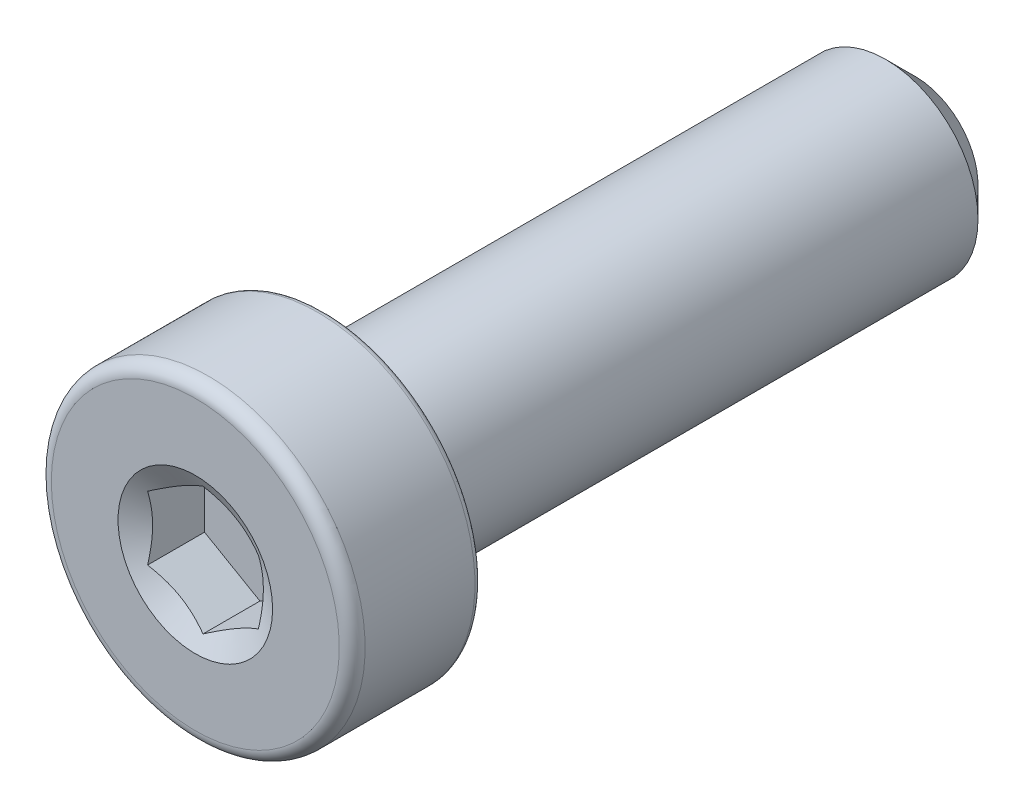
from build123d import *

# Parameters (mm, degrees)
CUT_EXTRUDE1_START = 9.75
CUT_EXTRUDE1_DEPTH = 1.75


with BuildPart() as part:
    # Sketch2 → Revolve1 (revolve)
    with BuildSketch(Plane(origin=(0, 0, 0), x_dir=(0, 0, -1), z_dir=(1, 0, 0)), mode=Mode.PRIVATE) as revolve1_sk:
        with BuildLine():
            Line((9.75, 0), (9.75, 1.7))
            Line((9.75, 1.7), (8.95, 2.5))
            Line((8.95, 2.5), (-6.25, 2.5))
            Line((-6.25, 2.5), (-6.25, 4.075))
            ThreePointArc((-6.25, 4.075), (-6.301256313, 4.198743687), (-6.425, 4.25))
            Line((-6.425, 4.25), (-9.4, 4.25))
            ThreePointArc((-9.4, 4.25), (-9.647487373, 4.147487373), (-9.75, 3.9))
            Line((-9.75, 3.9), (-9.75, 0))
            Line((-9.75, 0), (9.75, 0))
        make_face()
    revolve(revolve1_sk.sketch.rotate(Axis((0, 0, -9.75), (0, 0, 1)), 90), axis=Axis((0, 0, -9.75), (0, 0, 1)))

    # Sketch3 → Cut-Extrude1 (cut)
    with BuildSketch(Plane.XY.offset(CUT_EXTRUDE1_START)):
        Polygon((-1.5, 0.866025404), (-1.5, -0.866025404), (0, -1.732050808), (1.5, -0.866025404), (1.5, 0.866025404), (0, 1.732050808), align=None)
    extrude(amount=-CUT_EXTRUDE1_DEPTH, mode=Mode.SUBTRACT)

    # Cut-Extrude2 cone 1 section (through the dimple's axis) → Cut-Extrude2 (revolve, cut)
    with BuildSketch(Plane(origin=(0, 0, 9.75), x_dir=(0, -1, 0), z_dir=(1, 0, 0))):
        Polygon((0, 0), (2.093375673, 0), (0, 1.208611008), align=None)
    revolve(axis=Axis((0, 0, 9.75), (0, 0, -1)), mode=Mode.SUBTRACT)


solid = part.part
